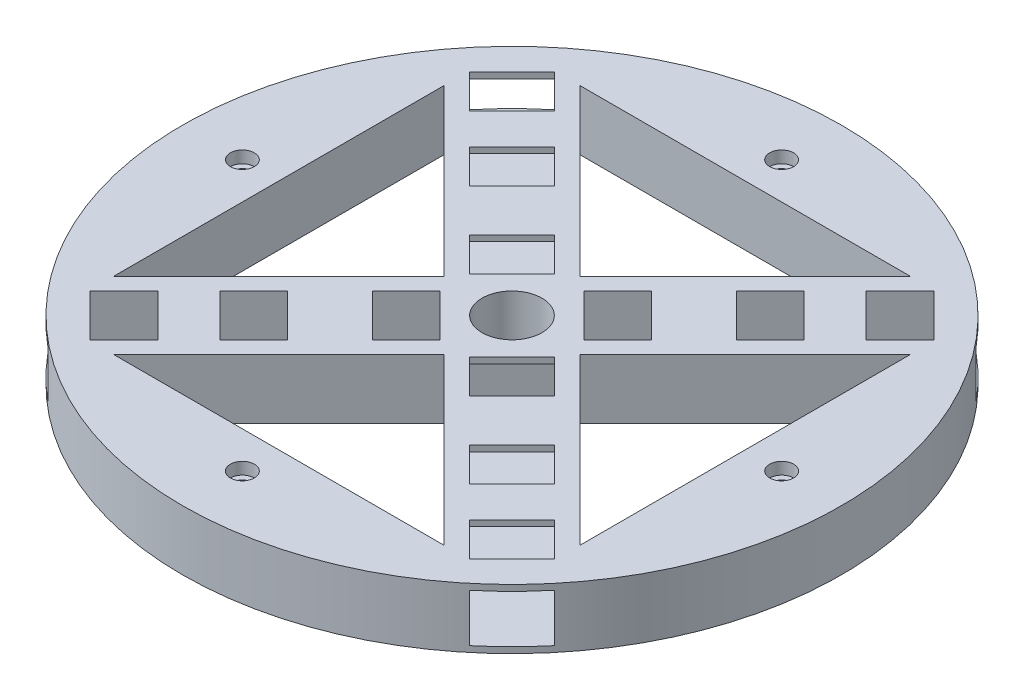
from build123d import *

# Parameters (mm, degrees)
SKETCH_2_R               = 27.5
SKETCH_2_R_2             = 0.525
EXTRUDE_1_DEPTH          = 5
SKETCH_5_W               = 5
SKETCH_5_H               = 4
CUT_EXTRUDE_1_DEPTH      = 44.181327292
PATTERN_CIRCULAR_1_COUNT = 4
CUT_EXTRUDE_2_DEPTH      = 2
PATTERN_CIRCULAR_2_COUNT = 4
SKETCH_7_R               = 2.5
CUT_EXTRUDE_3_DEPTH      = 40.210967853
SKETCH_8_R               = 1
CUT_EXTRUDE_4_DEPTH      = 1
PATTERN_CIRCULAR_3_COUNT = 4


with BuildPart() as part:
    # 草图2 → 凸台-拉伸1 (new body)
    with BuildSketch(Plane(origin=(0, 0, 0), x_dir=(1, 0, 0), z_dir=(0, 1, 0))):
        Circle(SKETCH_2_R)
        with Locations((0, 22.5)):
            Circle(SKETCH_2_R_2, mode=Mode.SUBTRACT)
        with Locations((22.5, -2e-09)):
            Circle(SKETCH_2_R_2, mode=Mode.SUBTRACT)
        with Locations((-2e-09, -22.500000002)):
            Circle(SKETCH_2_R_2, mode=Mode.SUBTRACT)
        with Locations((-22.500000002, 0)):
            Circle(SKETCH_2_R_2, mode=Mode.SUBTRACT)
        Polygon((-13.788582233, 19.445436483), (13.788582233, 19.445436483), (0, 5.656854249), align=None, mode=Mode.SUBTRACT)
        Polygon((-19.445436483, 13.788582233), (-19.445436483, -13.788582233), (-5.656854249, 0), align=None, mode=Mode.SUBTRACT)
        Polygon((-13.788582233, -19.445436483), (13.788582233, -19.445436483), (0, -5.656854249), align=None, mode=Mode.SUBTRACT)
        Polygon((19.445436483, 13.788582233), (19.445436483, -13.788582233), (5.656854249, 0), align=None, mode=Mode.SUBTRACT)
    extrude(amount=EXTRUDE_1_DEPTH)

    # 草图5 → 切除-拉伸1 (cut, through all)
    with BuildSketch(Plane(origin=(2.828427515, 4.42e-07, -2.828427515), x_dir=(0.7071067811865507, 0, 0.7071067811865444), z_dir=(-0.7071067811865401, -1.1050996923684133e-07, 0.7071067811865465))):
        with Locations((0, 2.5)):
            Rectangle(SKETCH_5_W, SKETCH_5_H)
    cut_extrude_1 = extrude(amount=-CUT_EXTRUDE_1_DEPTH, mode=Mode.SUBTRACT)

    # 阵列(圆周)1: 切除-拉伸1 ×4 about axis
    pattern_circular_1_axis = Axis((0, 5, 0), (0, -1, 0))
    for i in range(1, PATTERN_CIRCULAR_1_COUNT):
        add(cut_extrude_1.rotate(pattern_circular_1_axis, i * 360 / PATTERN_CIRCULAR_1_COUNT), mode=Mode.SUBTRACT)

    # 草图6 → 切除-拉伸2 (cut)
    with BuildSketch(Plane(origin=(0, 5, 0), x_dir=(1, 0, 0), z_dir=(0, 1, 0))):
        Polygon((-4.762221068, 1.226687162), (-1.226687162, 4.762221068), (-4.055114287, 7.590648193), (-7.590648193, 4.055114287), align=None)
        Polygon((-19.364916731, 15.829382825), (-16.536489606, 13.0009557), (-13.0009557, 16.536489606), (-15.829382825, 19.364916731), align=None)
        Polygon((-13.954609224, 10.419075318), (-11.126182099, 7.590648193), (-7.590648193, 11.126182099), (-10.419075318, 13.954609224), align=None)
    cut_extrude_2 = extrude(amount=-CUT_EXTRUDE_2_DEPTH, mode=Mode.SUBTRACT)

    # 阵列(圆周)2: 切除-拉伸2 ×4 about axis
    pattern_circular_2_axis = Axis((0, 5, 0), (0, -1, 0))
    for i in range(1, PATTERN_CIRCULAR_2_COUNT):
        add(cut_extrude_2.rotate(pattern_circular_2_axis, i * 360 / PATTERN_CIRCULAR_2_COUNT), mode=Mode.SUBTRACT)

    # 草图7 → 切除-拉伸3 (cut, through all)
    with BuildSketch(Plane(origin=(0, 5, 0), x_dir=(1, 0, 0), z_dir=(0, 1, 0))):
        Circle(SKETCH_7_R)
    extrude(amount=-CUT_EXTRUDE_3_DEPTH, mode=Mode.SUBTRACT)

    # 草图8 → 切除-拉伸4 (cut)
    with BuildSketch(Plane(origin=(0, 5, 0), x_dir=(1, 0, 0), z_dir=(0, 1, 0))):
        with Locations((-22.500000002, 0)):
            Circle(SKETCH_8_R)
    cut_extrude_4 = extrude(amount=-CUT_EXTRUDE_4_DEPTH, mode=Mode.SUBTRACT)

    # 阵列(圆周)3: 切除-拉伸4 ×4 about axis
    pattern_circular_3_axis = Axis((0, 5, 0), (0, -1, 0))
    for i in range(1, PATTERN_CIRCULAR_3_COUNT):
        add(cut_extrude_4.rotate(pattern_circular_3_axis, i * 360 / PATTERN_CIRCULAR_3_COUNT), mode=Mode.SUBTRACT)


solid = part.part
